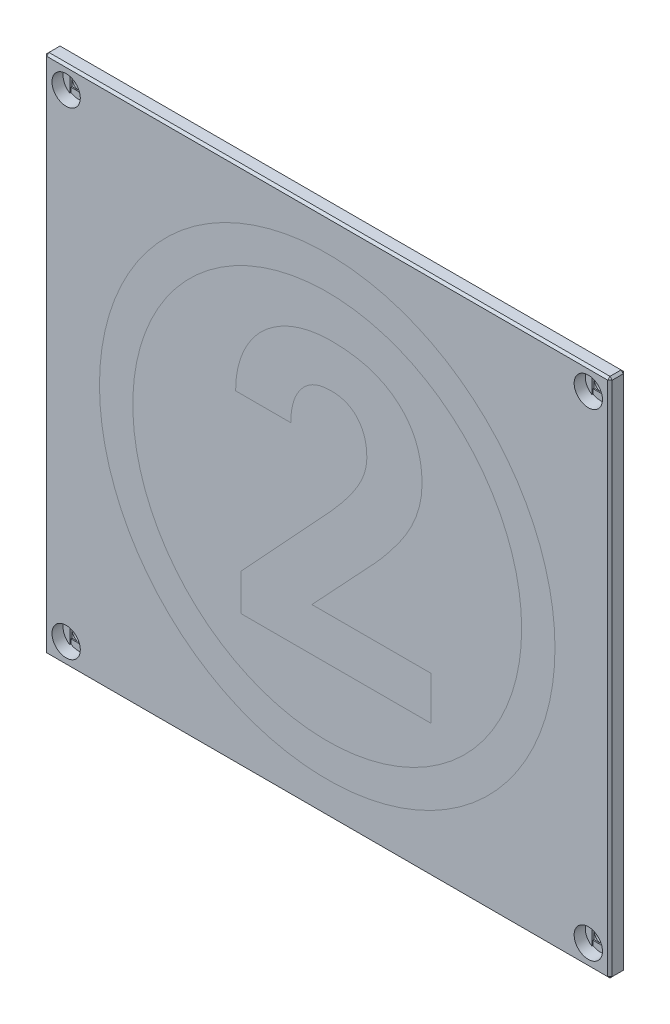
from build123d import *
from build123d.topology import SkipClean

# Parameters (mm, degrees)
SKETCH2_W               = 101.8
SKETCH2_H               = 93.8
SKETCH2_R               = 1.35
BOSS_EXTRUDE1_DEPTH     = 2.8
SKETCH3_R               = 2.55
CUT_EXTRUDE1_DEPTH      = 2
CUT_EXTRUDE2_DEPTH      = 0.2
SKETCH5_W               = 2.7
SKETCH5_H               = 2.7
CUT_EXTRUDE3_DEPTH      = 0.2
MIRROR2_COPY_1_DEPTH    = 0.2
MIRROR2_COPY_2_SKETCH_W = 2.7
MIRROR2_COPY_2_SKETCH_H = 2.7
MIRROR2_COPY_2_DEPTH    = 0.2
CHAMFER1_SIZE           = 0.4
SKETCH6_W               = 81.8
SKETCH6_H               = 73.8
CUT_EXTRUDE4_DEPTH      = 1.2
SKETCH7_R               = 41
SKETCH7_R_2             = 35
CUT_EXTRUDE5_DEPTH      = 1
SKETCH7_2_R             = 41
SKETCH7_2_R_2           = 35
BOSS_EXTRUDE2_DEPTH     = 1
CUT_EXTRUDE6_DEPTH      = 1
BOSS_EXTRUDE3_DEPTH     = 1


with BuildPart() as part:
    # Sketch2 → Boss-Extrude1 (new body)
    with BuildSketch(Plane.XY):
        with Locations((0, -6)):
            Rectangle(SKETCH2_W, SKETCH2_H)
        with Locations((-47, 37)):
            Circle(SKETCH2_R, mode=Mode.SUBTRACT)
        with Locations((47, 37)):
            Circle(SKETCH2_R, mode=Mode.SUBTRACT)
        with Locations((47, -49)):
            Circle(SKETCH2_R, mode=Mode.SUBTRACT)
        with Locations((-47, -49)):
            Circle(SKETCH2_R, mode=Mode.SUBTRACT)
    extrude(amount=BOSS_EXTRUDE1_DEPTH)

    # Sketch3 → Cut-Extrude1 (cut)
    with BuildSketch(Plane.XY.offset(2.8)):
        with Locations((-47, 37)):
            Circle(SKETCH3_R)
        with Locations((47, 37)):
            Circle(SKETCH3_R)
        with Locations((47, -49)):
            Circle(SKETCH3_R)
        with Locations((-47, -49)):
            Circle(SKETCH3_R)
    extrude(amount=-CUT_EXTRUDE1_DEPTH, mode=Mode.SUBTRACT)

    # Sketch4 → Cut-Extrude2 (cut)
    with SkipClean():  # the faces are left unmerged after this step: merging them gives an invalid solid
        with BuildSketch(Plane.XY.offset(0.8)):
            with BuildLine():
                Line((-48.35, 34.836669235), (-48.35, 39.163330765))
                ThreePointArc((-48.35, 39.163330765), (-47, 39.55), (-45.65, 39.163330765))
                Line((-45.65, 39.163330765), (-45.65, 34.836669235))
                ThreePointArc((-45.65, 34.836669235), (-47, 34.45), (-48.35, 34.836669235))
            make_face()
        cut_extrude2 = extrude(amount=-CUT_EXTRUDE2_DEPTH, mode=Mode.SUBTRACT)

    # Sketch5 → Cut-Extrude3 (cut)
    with SkipClean():  # the faces are left unmerged after this step: merging them gives an invalid solid
        with BuildSketch(Plane.XY.offset(0.6)):
            with Locations((-47, 37)):
                Rectangle(SKETCH5_W, SKETCH5_H)
        cut_extrude3 = extrude(amount=-CUT_EXTRUDE3_DEPTH, mode=Mode.SUBTRACT)

    # Mirror1: Cut-Extrude2, Cut-Extrude3 across plane
    with SkipClean():  # the faces are left unmerged after this step: merging them gives an invalid solid
        add(cut_extrude2.mirror(Plane.ZX.offset(-6)), mode=Mode.SUBTRACT)
        add(cut_extrude3.mirror(Plane.ZX.offset(-6)), mode=Mode.SUBTRACT)

    # Mirror2: Cut-Extrude2, Cut-Extrude3 across plane
    with SkipClean():  # the faces are left unmerged after this step: merging them gives an invalid solid
        add(cut_extrude2.mirror(Plane(origin=(0, 0, 0), x_dir=(0, 0, 1), z_dir=(1, 0, 0))), mode=Mode.SUBTRACT)
        add(cut_extrude3.mirror(Plane(origin=(0, 0, 0), x_dir=(0, 0, 1), z_dir=(1, 0, 0))), mode=Mode.SUBTRACT)

    # Mirror2 copy 1 sketch → Mirror2 copy 1 (cut)
    with SkipClean():  # the faces are left unmerged after this step: merging them gives an invalid solid
        with BuildSketch(Plane(origin=(0, -12, 0.8), x_dir=(-1, 0, 0), z_dir=(0, 0, 1))):
            with BuildLine():
                Line((-48.35, 34.836669235), (-48.35, 39.163330765))
                ThreePointArc((-48.35, 39.163330765), (-47, 39.55), (-45.65, 39.163330765))
                Line((-45.65, 39.163330765), (-45.65, 34.836669235))
                ThreePointArc((-45.65, 34.836669235), (-47, 34.45), (-48.35, 34.836669235))
            make_face()
        extrude(amount=-MIRROR2_COPY_1_DEPTH, mode=Mode.SUBTRACT)

    # Mirror2 copy 2 sketch → Mirror2 copy 2 (cut)
    with SkipClean():  # the faces are left unmerged after this step: merging them gives an invalid solid
        with BuildSketch(Plane(origin=(0, -12, 0.6), x_dir=(-1, 0, 0), z_dir=(0, 0, 1))):
            with Locations((-47, 37)):
                Rectangle(MIRROR2_COPY_2_SKETCH_W, MIRROR2_COPY_2_SKETCH_H)
        extrude(amount=-MIRROR2_COPY_2_DEPTH, mode=Mode.SUBTRACT)

    # Chamfer1
    chamfer1_edges = [part.edges().sort_by_distance(p)[0] for p in [
        (50.9, -6, 2.8),
        (0, 40.9, 2.8),
        (-50.9, -6, 2.8),
        (0, 40.9, 0),
        (50.9, -6, 0),
        (0, -52.9, 0),
        (-50.9, -6, 0),
        (-50.9, 40.9, 1.4),
        (50.9, 40.9, 1.4),
        (50.9, -52.9, 1.4),
        (-50.9, -52.9, 1.4),
        (0, -52.9, 2.8),
    ]]
    chamfer(chamfer1_edges, length=CHAMFER1_SIZE)

    # Sketch6 → Cut-Extrude4 (cut)
    with SkipClean():  # the faces are left unmerged after this step: merging them gives an invalid solid
        with BuildSketch(Plane(origin=(0, 0, 0), x_dir=(-1, 0, 0), z_dir=(0, 0, -1))):
            with Locations((0, -6)):
                Rectangle(SKETCH6_W, SKETCH6_H)
        extrude(amount=-CUT_EXTRUDE4_DEPTH, mode=Mode.SUBTRACT)

    # Sketch7 → Cut-Extrude5 (cut)
    with SkipClean():  # the faces are left unmerged after this step: merging them gives an invalid solid
        with BuildSketch(Plane.XY.offset(2.8)):
            with Locations((0, -6)):
                Circle(SKETCH7_R)
            with Locations((0, -6)):
                Circle(SKETCH7_R_2, mode=Mode.SUBTRACT)
        extrude(amount=-CUT_EXTRUDE5_DEPTH, mode=Mode.SUBTRACT)

    # Sketch8 → Cut-Extrude6 (cut)
    with SkipClean():  # the faces are left unmerged after this step: merging them gives an invalid solid
        with BuildSketch(Plane.XY.offset(2.8)):
            with BuildLine():
                Line((18.671022727, -28.9), (-15.501055195, -28.9))
                Line((-15.501055195, -28.9), (-15.501055195, -22.274594156))
                Line((-15.501055195, -22.274594156), (0.63125, -4.884172078))
                add(Edge.make_bspline(
                    [(0.63125, -4.884172078), (1.153277451, -4.292855043), (2.146557383, -3.167735389), (3.489118969, -1.506272711), (4.614642881, 0.038757574), (5.531438955, 1.477799135), (6.254834728, 2.841439855), (6.758035318, 4.1695038), (7.069448153, 5.467413282), (7.113481554, 6.32572019), (7.134902597, 6.743262987)],
                    knots=[0, 0, 0, 0, 1.39172186, 2.648077977, 3.767796567, 4.76286031, 5.657032287, 6.486124408, 7.263540997, 8, 8, 8, 8], degree=3))
                add(Edge.make_bspline(
                    [(7.134902597, 6.743262987), (7.118445512, 7.276005414), (7.087090374, 8.291021839), (6.769786109, 9.72439361), (6.241621668, 10.984152827), (5.60733002, 11.874698209), (5.028302195, 12.495851442), (4.530064095, 12.883158254), (3.995471939, 13.214394751), (3.418655987, 13.500854707), (2.788730275, 13.690966972), (2.122500599, 13.850084328), (1.408201929, 13.940647127), (0.915581702, 13.951532569), (0.661688312, 13.957142857)],
                    knots=[0, 0, 0, 0, 1.741445173, 3.317917556, 4.775785309, 6.182318557, 6.871305174, 7.548994693, 8.240112202, 8.928298033, 9.649436506, 10.387869313, 11.169117907, 12, 12, 12, 12], degree=3))
                add(Edge.make_bspline(
                    [(0.661688312, 13.957142857), (0.387329122, 13.949122126), (-0.146819306, 13.933506608), (-0.925115272, 13.818488237), (-1.657002545, 13.638358111), (-2.34656322, 13.3833698), (-2.99118454, 13.045988701), (-3.586094326, 12.627916029), (-4.144968715, 12.14576162), (-4.64669302, 11.586413684), (-5.102990563, 10.973785534), (-5.488156761, 10.302627713), (-5.829857506, 9.59447204), (-6.084904505, 8.827753466), (-6.304005462, 8.022940946), (-6.451792588, 7.170389323), (-6.546263196, 6.271919424), (-6.556889942, 5.657882139), (-6.562337662, 5.343100649)],
                    knots=[0, 0, 0, 0, 1.038938478, 2.022703719, 2.97346804, 3.889596282, 4.800694763, 5.721112353, 6.638225343, 7.590455763, 8.561544061, 9.526103818, 10.517513296, 11.534418921, 12.581617744, 13.674746768, 14.80797682, 16, 16, 16, 16], degree=3))
                Line((-6.562337662, 5.343100649), (-16.495373377, 5.343100649))
                add(Edge.make_bspline(
                    [(-16.495373377, 5.343100649), (-16.472833745, 6.089317638), (-16.428310573, 7.563341142), (-15.990087182, 9.712803635), (-15.323734547, 11.77162153), (-14.366953591, 13.70697381), (-13.160132284, 15.489920318), (-11.730459888, 17.097573105), (-10.051815444, 18.468784007), (-8.501752801, 19.449883434), (-7.166848132, 20.116905895), (-6.119646707, 20.555248133), (-5.039721957, 20.917594334), (-3.930506595, 21.227840696), (-2.783114737, 21.455409519), (-1.605298826, 21.630686517), (-0.39538628, 21.734275665), (0.421368014, 21.74428947), (0.834172078, 21.749350649)],
                    knots=[0, 0, 0, 0, 1.339479457, 2.645911622, 3.925978511, 5.219837812, 6.51112494, 7.785117038, 9.071488508, 10.393521003, 11.07305546, 11.751447338, 12.431851043, 13.118981017, 13.819870657, 14.532442814, 15.258267051, 16, 16, 16, 16], degree=3))
                add(Edge.make_bspline(
                    [(0.834172078, 21.749350649), (1.456907098, 21.737646404), (2.671022468, 21.714827221), (4.440562578, 21.538104219), (6.105120302, 21.263234511), (7.660848296, 20.855642003), (9.106919089, 20.326393159), (10.451070485, 19.688335577), (11.690955571, 18.93665069), (12.806890963, 18.056894891), (13.816455567, 17.089092945), (14.685863549, 16.007982115), (15.431503, 14.840733282), (16.033035825, 13.567820636), (16.497850687, 12.202229349), (16.834128553, 10.744393474), (17.024495809, 9.190124376), (17.053185494, 8.123647518), (17.067938312, 7.575243506)],
                    knots=[0, 0, 0, 0, 1.221355057, 2.381214963, 3.484979353, 4.527721614, 5.530967593, 6.501319317, 7.442287511, 8.368618289, 9.283498722, 10.179739645, 11.083414321, 11.99443794, 12.934353113, 13.907987765, 14.924244917, 16, 16, 16, 16], degree=3))
                add(Edge.make_bspline(
                    [(17.067938312, 7.575243506), (17.043098771, 6.95473273), (16.992757545, 5.697170305), (16.619494629, 3.806235067), (16.016153042, 1.897838615), (15.309531335, 0.31296178), (14.629099278, -0.985995249), (14.018070175, -2.011350852), (13.312994087, -3.069775085), (12.545269606, -4.186251153), (11.666914823, -5.32178064), (10.721490134, -6.516408603), (9.691781913, -7.752866399), (8.953838352, -8.57302218), (8.575649351, -8.993344156)],
                    knots=[0, 0, 0, 0, 1.17219725, 2.375641605, 3.628973427, 4.948364865, 5.648834636, 6.399719193, 7.202790194, 8.052119976, 8.959767041, 9.915067613, 10.931492139, 12, 12, 12, 12], degree=3))
                Line((8.575649351, -8.993344156), (-2.757548701, -21.107792208))
                Line((-2.757548701, -21.107792208), (18.671022727, -21.107792208))
                Line((18.671022727, -21.107792208), (18.671022727, -28.9))
            make_face()
        extrude(amount=-CUT_EXTRUDE6_DEPTH, mode=Mode.SUBTRACT)


with BuildPart() as body_2:
    # Sketch7<2> → Boss-Extrude2 (new body)
    with BuildSketch(Plane.XY.offset(2.8)):
        with Locations((0, -6)):
            Circle(SKETCH7_2_R)
        with Locations((0, -6)):
            Circle(SKETCH7_2_R_2, mode=Mode.SUBTRACT)
    extrude(amount=-BOSS_EXTRUDE2_DEPTH)


with BuildPart() as body_3:
    # Sketch8<2> → Boss-Extrude3 (new body)
    with BuildSketch(Plane.XY.offset(2.8)):
        with BuildLine():
            Line((18.671022727, -28.9), (-15.501055195, -28.9))
            Line((-15.501055195, -28.9), (-15.501055195, -22.274594156))
            Line((-15.501055195, -22.274594156), (0.63125, -4.884172078))
            add(Edge.make_bspline(
                [(0.63125, -4.884172078), (1.153277451, -4.292855043), (2.146557383, -3.167735389), (3.489118969, -1.506272711), (4.614642881, 0.038757574), (5.531438955, 1.477799135), (6.254834728, 2.841439855), (6.758035318, 4.1695038), (7.069448153, 5.467413282), (7.113481554, 6.32572019), (7.134902597, 6.743262987)],
                knots=[0, 0, 0, 0, 1.39172186, 2.648077977, 3.767796567, 4.76286031, 5.657032287, 6.486124408, 7.263540997, 8, 8, 8, 8], degree=3))
            add(Edge.make_bspline(
                [(7.134902597, 6.743262987), (7.118445512, 7.276005414), (7.087090374, 8.291021839), (6.769786109, 9.72439361), (6.241621668, 10.984152827), (5.60733002, 11.874698209), (5.028302195, 12.495851442), (4.530064095, 12.883158254), (3.995471939, 13.214394751), (3.418655987, 13.500854707), (2.788730275, 13.690966972), (2.122500599, 13.850084328), (1.408201929, 13.940647127), (0.915581702, 13.951532569), (0.661688312, 13.957142857)],
                knots=[0, 0, 0, 0, 1.741445173, 3.317917556, 4.775785309, 6.182318557, 6.871305174, 7.548994693, 8.240112202, 8.928298033, 9.649436506, 10.387869313, 11.169117907, 12, 12, 12, 12], degree=3))
            add(Edge.make_bspline(
                [(0.661688312, 13.957142857), (0.387329122, 13.949122126), (-0.146819306, 13.933506608), (-0.925115272, 13.818488237), (-1.657002545, 13.638358111), (-2.34656322, 13.3833698), (-2.99118454, 13.045988701), (-3.586094326, 12.627916029), (-4.144968715, 12.14576162), (-4.64669302, 11.586413684), (-5.102990563, 10.973785534), (-5.488156761, 10.302627713), (-5.829857506, 9.59447204), (-6.084904505, 8.827753466), (-6.304005462, 8.022940946), (-6.451792588, 7.170389323), (-6.546263196, 6.271919424), (-6.556889942, 5.657882139), (-6.562337662, 5.343100649)],
                knots=[0, 0, 0, 0, 1.038938478, 2.022703719, 2.97346804, 3.889596282, 4.800694763, 5.721112353, 6.638225343, 7.590455763, 8.561544061, 9.526103818, 10.517513296, 11.534418921, 12.581617744, 13.674746768, 14.80797682, 16, 16, 16, 16], degree=3))
            Line((-6.562337662, 5.343100649), (-16.495373377, 5.343100649))
            add(Edge.make_bspline(
                [(-16.495373377, 5.343100649), (-16.472833745, 6.089317638), (-16.428310573, 7.563341142), (-15.990087182, 9.712803635), (-15.323734547, 11.77162153), (-14.366953591, 13.70697381), (-13.160132284, 15.489920318), (-11.730459888, 17.097573105), (-10.051815444, 18.468784007), (-8.501752801, 19.449883434), (-7.166848132, 20.116905895), (-6.119646707, 20.555248133), (-5.039721957, 20.917594334), (-3.930506595, 21.227840696), (-2.783114737, 21.455409519), (-1.605298826, 21.630686517), (-0.39538628, 21.734275665), (0.421368014, 21.74428947), (0.834172078, 21.749350649)],
                knots=[0, 0, 0, 0, 1.339479457, 2.645911622, 3.925978511, 5.219837812, 6.51112494, 7.785117038, 9.071488508, 10.393521003, 11.07305546, 11.751447338, 12.431851043, 13.118981017, 13.819870657, 14.532442814, 15.258267051, 16, 16, 16, 16], degree=3))
            add(Edge.make_bspline(
                [(0.834172078, 21.749350649), (1.456907098, 21.737646404), (2.671022468, 21.714827221), (4.440562578, 21.538104219), (6.105120302, 21.263234511), (7.660848296, 20.855642003), (9.106919089, 20.326393159), (10.451070485, 19.688335577), (11.690955571, 18.93665069), (12.806890963, 18.056894891), (13.816455567, 17.089092945), (14.685863549, 16.007982115), (15.431503, 14.840733282), (16.033035825, 13.567820636), (16.497850687, 12.202229349), (16.834128553, 10.744393474), (17.024495809, 9.190124376), (17.053185494, 8.123647518), (17.067938312, 7.575243506)],
                knots=[0, 0, 0, 0, 1.221355057, 2.381214963, 3.484979353, 4.527721614, 5.530967593, 6.501319317, 7.442287511, 8.368618289, 9.283498722, 10.179739645, 11.083414321, 11.99443794, 12.934353113, 13.907987765, 14.924244917, 16, 16, 16, 16], degree=3))
            add(Edge.make_bspline(
                [(17.067938312, 7.575243506), (17.043098771, 6.95473273), (16.992757545, 5.697170305), (16.619494629, 3.806235067), (16.016153042, 1.897838615), (15.309531335, 0.31296178), (14.629099278, -0.985995249), (14.018070175, -2.011350852), (13.312994087, -3.069775085), (12.545269606, -4.186251153), (11.666914823, -5.32178064), (10.721490134, -6.516408603), (9.691781913, -7.752866399), (8.953838352, -8.57302218), (8.575649351, -8.993344156)],
                knots=[0, 0, 0, 0, 1.17219725, 2.375641605, 3.628973427, 4.948364865, 5.648834636, 6.399719193, 7.202790194, 8.052119976, 8.959767041, 9.915067613, 10.931492139, 12, 12, 12, 12], degree=3))
            Line((8.575649351, -8.993344156), (-2.757548701, -21.107792208))
            Line((-2.757548701, -21.107792208), (18.671022727, -21.107792208))
            Line((18.671022727, -21.107792208), (18.671022727, -28.9))
        make_face()
    extrude(amount=-BOSS_EXTRUDE3_DEPTH)


solid = Compound([part.part, body_2.part, body_3.part])
